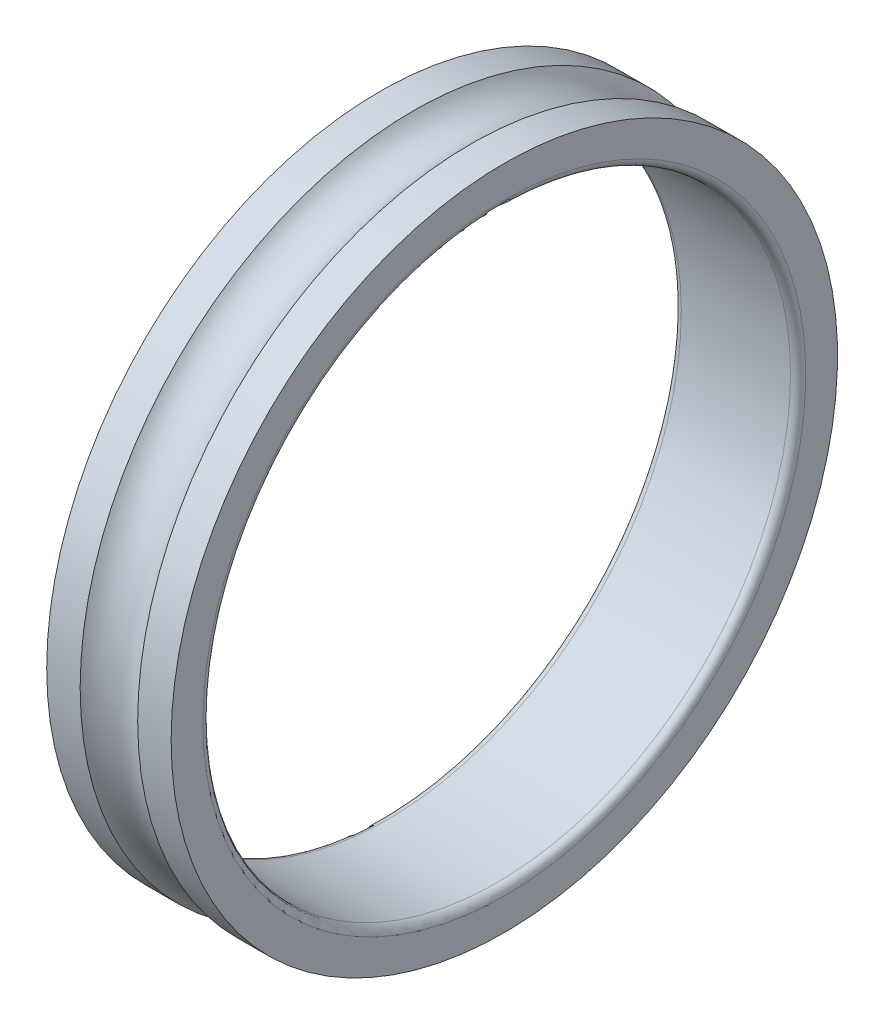
from build123d import *


with BuildPart() as part:
    # Schizzo1 → Rivoluzione1 (revolve)
    with BuildSketch(Plane.XY, mode=Mode.PRIVATE) as rivoluzione1_sk:
        with BuildLine():
            Line((1.1, 42.5), (16.9, 42.5))
            ThreePointArc((16.9, 42.5), (17.677817459, 42.822182541), (18, 43.6))
            Line((18, 43.6), (18, 48.2))
            Line((18, 48.2), (13.161482939, 48.2))
            ThreePointArc((13.161482939, 48.2), (9, 46.0905), (4.838517061, 48.2))
            Line((4.838517061, 48.2), (0, 48.2))
            Line((0, 48.2), (0, 43.6))
            ThreePointArc((0, 43.6), (0.322182541, 42.822182541), (1.1, 42.5))
        make_face()
    revolve(rivoluzione1_sk.sketch.rotate(Axis((50, 0, 0), (-1, 0, 0)), 270), axis=Axis((50, 0, 0), (-1, 0, 0)))


solid = part.part
